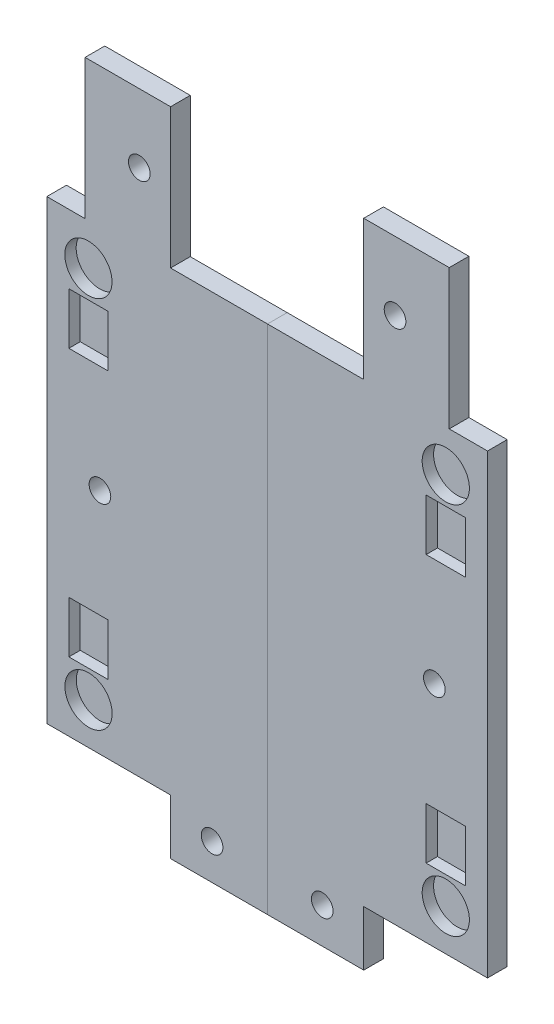
from build123d import *

# Parameters (mm, degrees)
BOSS_EXTRUDE1_DEPTH = 5
SKETCH3_R           = 2.750001848
SKETCH3_R_2         = 2.749998122
SKETCH3_R_3         = 2.749994397
CUT_EXTRUDE1_DEPTH  = 187.925914257
SKETCH4_R           = 5.999999003
SKETCH4_R_2         = 6.000067841
SKETCH4_W           = 9.999997914
SKETCH4_H           = 13.120189309
CUT_EXTRUDE4_DEPTH  = 2.89
BOSS_EXTRUDE2_DEPTH = 5
SKETCH6_R           = 2.749994397
SKETCH6_R_2         = 2.750000188
SKETCH6_R_3         = 2.750001848
CUT_EXTRUDE5_DEPTH  = 187.925914257
SKETCH7_R           = 5.999997258
SKETCH7_R_2         = 5.99999962
SKETCH7_W           = 9.999997914
SKETCH7_H           = 13.120189309
CUT_EXTRUDE13_DEPTH = 2.89


with BuildPart() as part:
    # Sketch1 → Boss-Extrude1 (new body)
    with BuildSketch(Plane.XY):
        Polygon((-24.546734989, 142.770305276), (0.08200459, 142.770305276), (0.08200459, 26.770308614), (0.08200459, 12.770309113), (-24.546734989, 12.770309113), (-24.546734989, 26.770308614), (-55.999945849, 26.770308614), (-55.999945849, 142.770305276), (-46.273332089, 142.770305276), (-46.273332089, 178.270310163), (-24.546734989, 178.270310163), align=None)
    extrude(amount=-BOSS_EXTRUDE1_DEPTH)

    # Sketch3 → Cut-Extrude1 (cut, through all)
    with BuildSketch(Plane.XY):
        with Locations((-13.999991119, 21.852403879)):
            Circle(SKETCH3_R)
        with Locations((-42.500052601, 84.806021303)):
            Circle(SKETCH3_R_2)
        with Locations((-32.499950379, 160.85241735)):
            Circle(SKETCH3_R_3)
    extrude(amount=-CUT_EXTRUDE1_DEPTH, mode=Mode.SUBTRACT)

    # Sketch4 → Cut-Extrude4 (cut)
    with BuildSketch(Plane.XY):
        with Locations((-45.399973286, 37.270279719)):
            Circle(SKETCH4_R)
        with Locations((-45.429093073, 132.270276546)):
            Circle(SKETCH4_R_2)
        with Locations((-45.399982482, 50.808746368)):
            Rectangle(SKETCH4_W, SKETCH4_H)
        with Locations((-45.399978757, 118.73177439)):
            Rectangle(SKETCH4_W, SKETCH4_H)
    extrude(amount=-CUT_EXTRUDE4_DEPTH, mode=Mode.SUBTRACT)


with BuildPart() as body_2:
    # Sketch5 → Boss-Extrude2 (new body)
    with BuildSketch(Plane.XY):
        Polygon((46.273332089, 142.770305276), (55.999945849, 142.770305276), (55.999945849, 26.770308614), (24.546734989, 26.770308614), (24.546734989, 12.770309113), (0.08200459, 12.770309113), (0.08200459, 26.770308614), (0.08200459, 142.770305276), (24.546734989, 142.770305276), (24.546734989, 178.270310163), (46.273332089, 178.270310163), align=None)
    extrude(amount=-BOSS_EXTRUDE2_DEPTH)

    # Sketch6 → Cut-Extrude5 (cut, through all)
    with BuildSketch(Plane.XY):
        with Locations((32.499950267, 160.85241735)):
            Circle(SKETCH6_R)
        with Locations((42.50005426, 84.806023369)):
            Circle(SKETCH6_R_2)
        with Locations((13.999977744, 21.852403879)):
            Circle(SKETCH6_R_3)
    extrude(amount=-CUT_EXTRUDE5_DEPTH, mode=Mode.SUBTRACT)

    # Sketch7 → Cut-Extrude13 (cut)
    with BuildSketch(Plane.XY):
        with Locations((45.399993658, 132.270276546)):
            Circle(SKETCH7_R)
        with Locations((45.399971013, 37.270276375)):
            Circle(SKETCH7_R_2)
        with Locations((45.399978757, 118.73177439)):
            Rectangle(SKETCH7_W, SKETCH7_H)
        with Locations((45.399982482, 50.808746368)):
            Rectangle(SKETCH7_W, SKETCH7_H)
    extrude(amount=-CUT_EXTRUDE13_DEPTH, mode=Mode.SUBTRACT)


solid = Compound([part.part, body_2.part])
